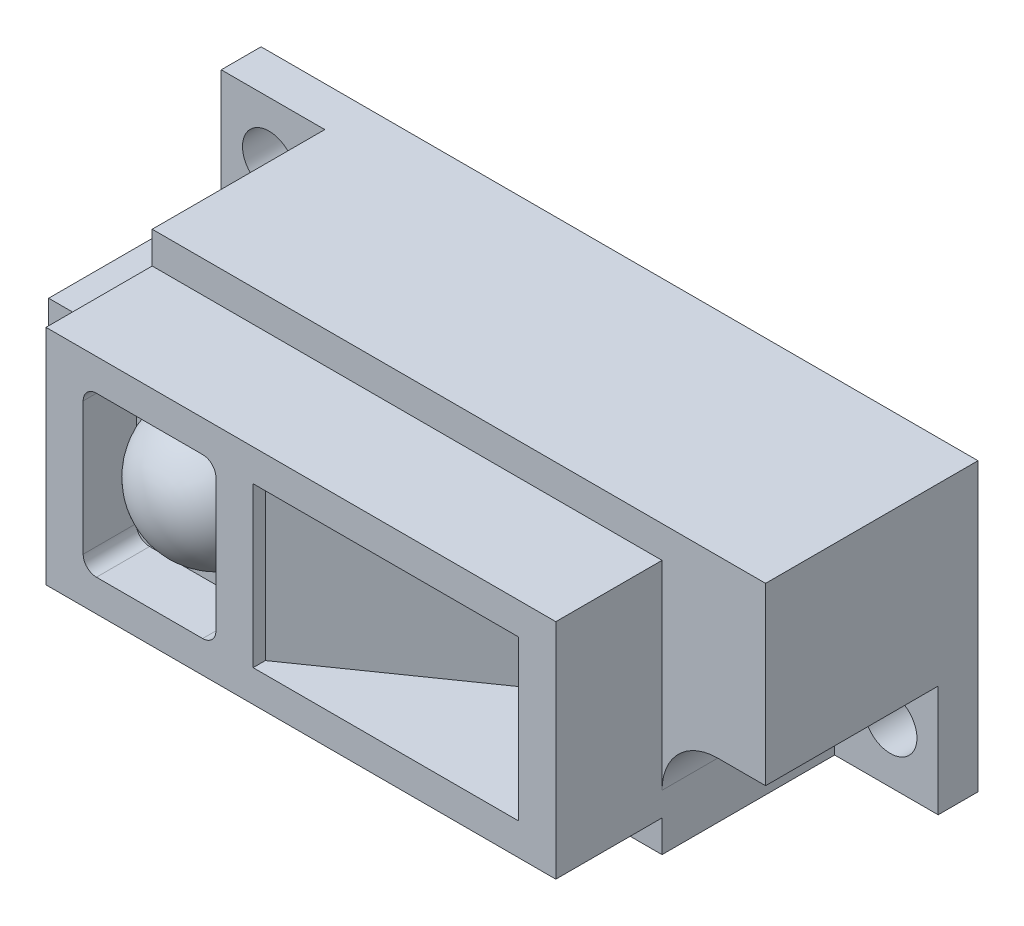
from build123d import *

# Parameters (mm, degrees)
SKETCH1_W           = 27
SKETCH1_H           = 10.8
BOSS_EXTRUDE1_DEPTH = 8
SKETCH2_R           = 1
CUT_EXTRUDE3_DEPTH  = 17.595481313
SKETCH2_3_R         = 1
CUT_EXTRUDE4_DEPTH  = 6.5
SKETCH6_W           = 9.85
SKETCH6_H           = 8
CUT_EXTRUDE5_DEPTH  = 1.2
SKETCH7_W           = 19.2
SKETCH7_H           = 8.4
BOSS_EXTRUDE2_DEPTH = 4
CUT_EXTRUDE6_DEPTH  = 2
SKETCH10_R          = 2.45
BOSS_EXTRUDE5_DEPTH = 0.1
DOME1_FACE_RADIUS   = 2.45
DOME1_HEIGHT        = 1.9
SKETCH11_W          = 10
SKETCH11_H          = 6
CUT_EXTRUDE7_DEPTH  = 5
SKETCH12_R          = 1.5
CUT_EXTRUDE8_DEPTH  = 0.1
BOSS_EXTRUDE6_REACH = 21.92
DOME2_FACE_RADIUS   = 1.5
DOME2_HEIGHT        = 1.3
SKETCH14_W          = 8.7
SKETCH14_H          = 1
BOSS_EXTRUDE7_DEPTH = 3.5
SKETCH15_W          = 6
SKETCH15_H          = 3
BOSS_EXTRUDE9_DEPTH = 4
SHELL1_T            = -0.3


with BuildPart() as part:
    # Sketch1 → Boss-Extrude1 (new body)
    with BuildSketch(Plane.XY):
        Rectangle(SKETCH1_W, SKETCH1_H)
    extrude(amount=BOSS_EXTRUDE1_DEPTH)

    # Sketch2 → Cut-Extrude3 (cut, through all)
    with BuildSketch(Plane.XY.offset(8)):
        with Locations((-11.7, 3.3)):
            Circle(SKETCH2_R)
        with Locations((11.7, -3.3)):
            Circle(SKETCH2_R)
    extrude(amount=-CUT_EXTRUDE3_DEPTH, mode=Mode.SUBTRACT)

    # Sketch2<3> → Cut-Extrude4 (cut)
    # profile 1 of 2: a face of its own
    with BuildSketch(Plane.XY.offset(8)):
        with BuildLine():
            Line((11.7, -1.2), (13.5, -1.2))
            Line((13.5, -1.2), (13.5, -5.4))
            Line((13.5, -5.4), (9.6, -5.4))
            Line((9.6, -5.4), (9.6, -3.3))
            ThreePointArc((9.6, -3.3), (10.21507576, -1.81507576), (11.7, -1.2))
        make_face()
        with Locations((11.7, -3.3)):
            Circle(SKETCH2_3_R, mode=Mode.SUBTRACT)
    # profile 2 of 2: a face of its own
    with BuildSketch(Plane.XY.offset(8)):
        with BuildLine():
            Line((-9.6, 3.3), (-9.6, 5.4))
            Line((-9.6, 5.4), (-13.5, 5.4))
            Line((-13.5, 5.4), (-13.5, 1.2))
            Line((-13.5, 1.2), (-11.7, 1.2))
            ThreePointArc((-11.7, 1.2), (-10.21507576, 1.81507576), (-9.6, 3.3))
        make_face()
        with Locations((-11.7, 3.3)):
            Circle(SKETCH2_3_R, mode=Mode.SUBTRACT)
    extrude(amount=-CUT_EXTRUDE4_DEPTH, mode=Mode.SUBTRACT)

    # Sketch6 → Cut-Extrude5 (cut)
    with BuildSketch(Plane.XZ.offset(5.4)):
        with Locations((-8.575, 4)):
            Rectangle(SKETCH6_W, SKETCH6_H)
    extrude(amount=-CUT_EXTRUDE5_DEPTH, mode=Mode.SUBTRACT)

    # Sketch7 → Boss-Extrude2 (add)
    with BuildSketch(Plane.XY.offset(8)):
        Rectangle(SKETCH7_W, SKETCH7_H)
    extrude(amount=BOSS_EXTRUDE2_DEPTH)

    # Sketch9 → Cut-Extrude6 (cut)
    with BuildSketch(Plane.XY.offset(12)):
        with BuildLine():
            Line((-7.7, 3), (-3.7, 3))
            ThreePointArc((-3.7, 3), (-3.346446609, 2.853553391), (-3.2, 2.5))
            Line((-3.2, 2.5), (-3.2, -2.5))
            ThreePointArc((-3.2, -2.5), (-3.346446609, -2.853553391), (-3.7, -3))
            Line((-3.7, -3), (-7.7, -3))
            ThreePointArc((-7.7, -3), (-8.053553391, -2.853553391), (-8.2, -2.5))
            Line((-8.2, -2.5), (-8.2, 2.5))
            ThreePointArc((-8.2, 2.5), (-8.053553391, 2.853553391), (-7.7, 3))
        make_face()
    extrude(amount=-CUT_EXTRUDE6_DEPTH, mode=Mode.SUBTRACT)

    # Sketch10 → Boss-Extrude5 (add)
    with BuildSketch(Plane.XY.offset(10)):
        with Locations(Location((-5.7, 0, 0), (0, 0, 180))):
            Circle(SKETCH10_R)
    extrude(amount=BOSS_EXTRUDE5_DEPTH)

    # Dome1: a dome of height H over a round flat face of radius A is a cap of a sphere of radius (A * A + H * H) / (2 * H)
    dome1_r = (DOME1_FACE_RADIUS * DOME1_FACE_RADIUS + DOME1_HEIGHT * DOME1_HEIGHT) / (2 * DOME1_HEIGHT)
    dome1_base = Plane((-5.7, 0, 10.1), z_dir=(0, 0, 1))
    with Locations(dome1_base.offset(DOME1_HEIGHT - dome1_r)):
        dome1_ball = Sphere(dome1_r, mode=Mode.PRIVATE)
    add(split(dome1_ball, bisect_by=dome1_base, keep=Keep.TOP, mode=Mode.PRIVATE))

    # Sketch11 → Cut-Extrude7 (cut)
    with BuildSketch(Plane.XY.offset(12)):
        with Locations((3.2, 0)):
            Rectangle(SKETCH11_W, SKETCH11_H)
    extrude(amount=-CUT_EXTRUDE7_DEPTH, mode=Mode.SUBTRACT)

    # Sketch12 → Cut-Extrude8 (cut)
    with BuildSketch(Plane.XY.offset(7)):
        with Locations((6.584374757, 0)):
            Circle(SKETCH12_R)
    extrude(amount=-CUT_EXTRUDE8_DEPTH, mode=Mode.SUBTRACT)

    # Sketch13 → Boss-Extrude6 (add, up to next)
    with BuildSketch(Plane.XZ.offset(-3), mode=Mode.PRIVATE) as boss_extrude6_sk1:
        Polygon((-1.8, 11.537973276), (4.7, 7), (-1.8, 7), align=None)
    boss_extrude6_tool1 = extrude(boss_extrude6_sk1.sketch, amount=BOSS_EXTRUDE6_REACH, mode=Mode.PRIVATE) - part.part
    add(boss_extrude6_tool1.solids().sort_by_distance((0.366667, 3, 8.512658))[0])

    # Dome2: a dome of height H over a round flat face of radius A is a cap of a sphere of radius (A * A + H * H) / (2 * H)
    dome2_r = (DOME2_FACE_RADIUS * DOME2_FACE_RADIUS + DOME2_HEIGHT * DOME2_HEIGHT) / (2 * DOME2_HEIGHT)
    dome2_base = Plane((6.584374757, 0, 6.9), z_dir=(0, 0, 1))
    with Locations(dome2_base.offset(DOME2_HEIGHT - dome2_r)):
        dome2_ball = Sphere(dome2_r, mode=Mode.PRIVATE)
    add(split(dome2_ball, bisect_by=dome2_base, keep=Keep.TOP, mode=Mode.PRIVATE))


with BuildPart() as body_2:
    # Sketch14 → Boss-Extrude7 (new body)
    with BuildSketch(Plane.XZ.offset(4.2)):
        with Locations((-8, 2)):
            Rectangle(SKETCH14_W, SKETCH14_H)
    extrude(amount=BOSS_EXTRUDE7_DEPTH)


with BuildPart() as body_3:
    # Sketch15 → Boss-Extrude9 (new body)
    with BuildSketch(Plane(origin=(0, 0, 1.5), x_dir=(-1, 0, 0), z_dir=(0, 0, -1))):
        with Locations((8, -5.7)):
            Rectangle(SKETCH15_W, SKETCH15_H)
    extrude(amount=BOSS_EXTRUDE9_DEPTH)

    # Shell1
    shell1_openings = [body_3.faces().sort_by_distance(p)[0] for p in [
        (-8, -5.7, -2.5),
    ]]
    offset(amount=SHELL1_T, openings=shell1_openings, kind=Kind.INTERSECTION)


solid = Compound([part.part, body_2.part, body_3.part])
